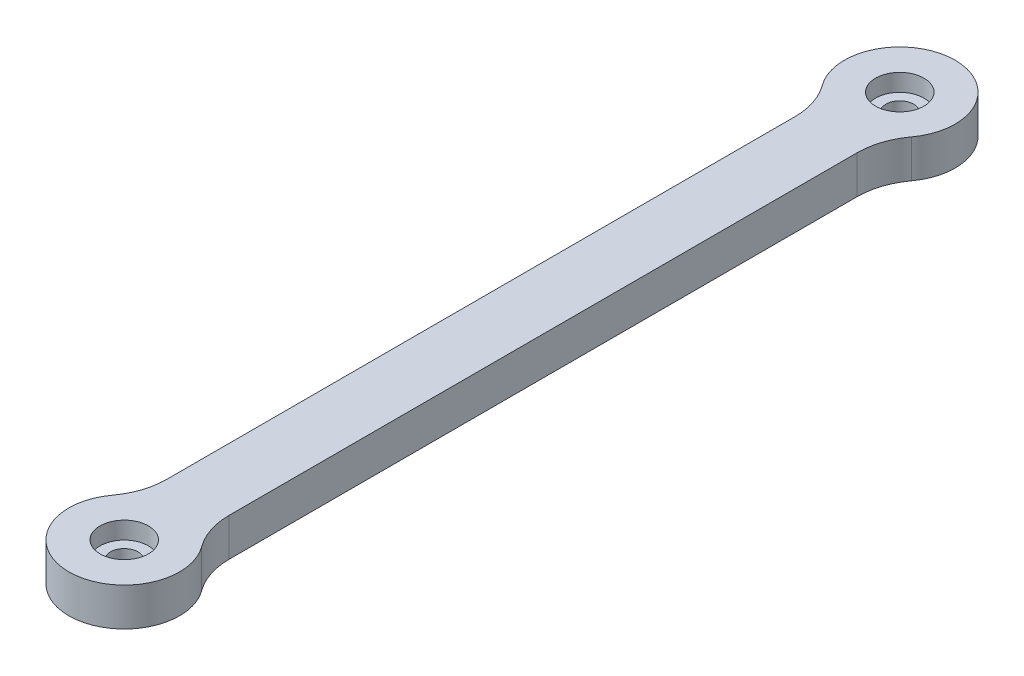
from build123d import *

# Parameters (mm, degrees)
SKETCH1_R           = 2
BOSS_EXTRUDE1_DEPTH = 5.5
CUT_EXTRUDE1_START  = -2.5
SKETCH2_R           = 3.5
SKETCH2_R_2         = 2
CUT_EXTRUDE1_DEPTH  = 2.5


with BuildPart() as part:
    # Sketch1 → Boss-Extrude1 (new body)
    with BuildSketch(Plane(origin=(0, 0, 0), x_dir=(1, 0, 0), z_dir=(0, 1, 0))):
        with BuildLine():
            Line((-4.5, 45.334635496), (-4.5, -45.334635496))
            ThreePointArc((-4.5, -45.334635496), (-4.998538124, -48.452683318), (-6.444444444, -51.259837998))
            ThreePointArc((-6.444444444, -51.259837998), (0, -64), (6.444444444, -51.259837998))
            ThreePointArc((6.444444444, -51.259837998), (4.998538124, -48.452683318), (4.5, -45.334635496))
            Line((4.5, -45.334635496), (4.5, 45.334635496))
            ThreePointArc((4.5, 45.334635496), (4.998538124, 48.452683318), (6.444444444, 51.259837998))
            ThreePointArc((6.444444444, 51.259837998), (0, 64), (-6.444444444, 51.259837998))
            ThreePointArc((-6.444444444, 51.259837998), (-4.998538124, 48.452683318), (-4.5, 45.334635496))
        make_face()
        with Locations(Location((0, 56, 0), (0, 0, 270))):
            Circle(SKETCH1_R, mode=Mode.SUBTRACT)
        with Locations(Location((0, -56, 0), (0, 0, 90))):
            Circle(SKETCH1_R, mode=Mode.SUBTRACT)
    extrude(amount=BOSS_EXTRUDE1_DEPTH)

    # Sketch2 → Cut-Extrude1 (cut)
    # profile 1 of 2: a face of its own
    with BuildSketch(Plane(origin=(0, 5.5, 0), x_dir=(1, 0, 0), z_dir=(0, 1, 0)).offset(CUT_EXTRUDE1_START)):
        with Locations(Location((0, 56, 0), (0, 0, 270))):
            Circle(SKETCH2_R)
        with Locations(Location((0, 56, 0), (0, 0, 270))):
            Circle(SKETCH2_R_2, mode=Mode.SUBTRACT)
    # profile 2 of 2: a face of its own
    with BuildSketch(Plane(origin=(0, 5.5, 0), x_dir=(1, 0, 0), z_dir=(0, 1, 0)).offset(CUT_EXTRUDE1_START)):
        with Locations(Location((0, -56, 0), (0, 0, 270))):
            Circle(SKETCH2_R)
        with Locations(Location((0, -56, 0), (0, 0, 90))):
            Circle(SKETCH2_R_2, mode=Mode.SUBTRACT)
    extrude(amount=CUT_EXTRUDE1_DEPTH, mode=Mode.SUBTRACT)


solid = part.part
